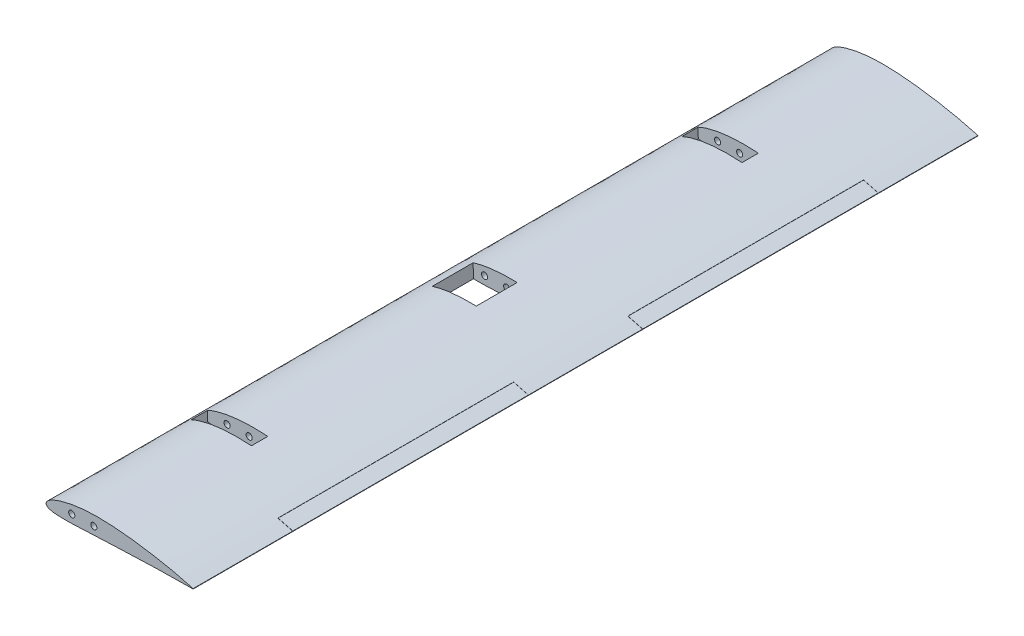
from build123d import *

# Parameters (mm, degrees)
SKETCH2_R               = 4.7625
EXTRUDE_AIRFOIL_DEPTH   = 1219.2
AILERONS_DEPTH          = 1241.930446903
AILERONS_DEPTH_BACK     = 1241.930446903
CUT_EXTRUDE1_DEPTH      = 1241.650515326
CUT_EXTRUDE1_DEPTH_BACK = 1241.650515326
SKETCH5_W               = 25.4
SKETCH5_H               = 93.98
SKETCH5_W_2             = 63.5
SKETCH5_H_2             = 68.58


with BuildPart() as part:
    # Sketch2 → Extrude airfoil (new body)
    with BuildSketch(Plane.XY):
        with BuildLine():
            Line((228.6, 12.387025086), (228.6, 11.792831891))
            add(Edge.make_bspline(
                [(228.6, 12.387025086), (224.79499634, 13.422833003), (217.203351463, 15.489450166), (201.995086366, 19.24706995), (182.976626701, 23.398782778), (160.101034919, 27.491378445), (137.243176809, 30.846032277), (114.372582505, 33.23890504), (91.503980941, 34.73131665), (72.412997667, 34.746410141), (57.169927463, 33.691843848), (45.722178876, 32.302790192), (34.249688597, 30.254339076), (24.742840243, 27.790786051), (17.124502123, 25.302700119), (11.38009907, 22.953832003), (6.478661385, 20.413593164), (2.224209454, 17.375019555), (-1.479318567, 12.488031674), (2.518152586, 8.750563835), (6.597176672, 7.283468722), (11.455013829, 6.293244116), (17.192107473, 5.789786203), (24.819037957, 5.433479126), (34.346917188, 5.460166768), (45.776283997, 5.77999863), (57.197586321, 6.388979964), (72.433369023, 7.101546318), (91.474845089, 8.015960902), (114.332736884, 8.874603332), (137.183285679, 9.828052553), (160.036020936, 10.640146808), (182.890586988, 11.237493082), (201.936912913, 11.54078297), (217.172860417, 11.740515028), (224.791022029, 11.77539325), (228.6, 11.792831891)],
                knots=[0, 0, 0, 0, 0.025304886, 0.050487653, 0.100520433, 0.150190716, 0.199586607, 0.248740009, 0.297715539, 0.346600594, 0.371102737, 0.395726297, 0.420570145, 0.445825119, 0.458702216, 0.471919982, 0.485786003, 0.493461051, 0.506863029, 0.51614777, 0.522766003, 0.535269014, 0.547551134, 0.559786371, 0.584228898, 0.60868081, 0.633151284, 0.657621757, 0.706558114, 0.75548187, 0.804405627, 0.853320224, 0.902221408, 0.951113136, 0.975557228, 1, 1, 1, 1], degree=3))
        make_face()
        with Locations(Location((40.005, 18.43992729, 0), (0, 0, 180))):
            Circle(SKETCH2_R, mode=Mode.SUBTRACT)
        with Locations(Location((74.283249673, 19.337534848, 0), (0, 0, 180))):
            Circle(SKETCH2_R, mode=Mode.SUBTRACT)
    extrude(amount=EXTRUDE_AIRFOIL_DEPTH)

    # Sketch3 → Ailerons (cut, two sides: drawn at the far end of the back side and taken through both)
    with BuildSketch(Plane(origin=(0, 0, 0), x_dir=(1, 0, 0), z_dir=(0, 1, 0)).offset(-AILERONS_DEPTH_BACK)):
        Polygon((228.6, -520.7), (205.74, -520.7), (205.74, -154.94), (228.6, -154.94), (228.6, -154.686), (205.486, -154.686), (205.486, -520.954), (228.6, -520.954), align=None)
        Polygon((228.6, -1064.26), (205.74, -1064.26), (205.74, -698.5), (228.6, -698.5), (228.6, -698.246), (205.486, -698.246), (205.486, -1064.514), (228.6, -1064.514), align=None)
    extrude(amount=AILERONS_DEPTH + AILERONS_DEPTH_BACK, mode=Mode.SUBTRACT)


with BuildPart() as ailerons_piece_1:
    # of the separate pieces the step leaves, piece 1, a body of its own (ailerons_pieces)
    add(part.part.solids().sort_by_distance((228.6, 12.387025086, 0))[0])

    # Sketch5 → Cut-Extrude1 (cut, two sides: drawn at the far end of the back side and taken through both)
    with BuildSketch(Plane(origin=(-0.455122883, 17.380441686, 0), x_dir=(0, 0, -1), z_dir=(-0.026176948307859344, 0.9996573249755578, 0)).offset(-CUT_EXTRUDE1_DEPTH_BACK)):
        with Locations((-990.6, -57.15)):
            Rectangle(SKETCH5_W, SKETCH5_H)
        with Locations((-228.6, -57.15)):
            Rectangle(SKETCH5_W, SKETCH5_H)
        with Locations((-609.6, -57.15)):
            Rectangle(SKETCH5_W_2, SKETCH5_H_2)
    extrude(amount=CUT_EXTRUDE1_DEPTH + CUT_EXTRUDE1_DEPTH_BACK, mode=Mode.SUBTRACT)


with BuildPart() as ailerons_piece_2:
    # of the separate pieces the step leaves, piece 2, a body of its own (ailerons_pieces)
    add(part.part.solids().sort_by_distance((228.6, 11.792831891, 154.94))[0])


with BuildPart() as ailerons_piece_3:
    # of the separate pieces the step leaves, piece 3, a body of its own (ailerons_pieces)
    add(part.part.solids().sort_by_distance((228.6, 11.792831891, 698.5))[0])


solid = Compound([ailerons_piece_1.part, ailerons_piece_2.part, ailerons_piece_3.part])
